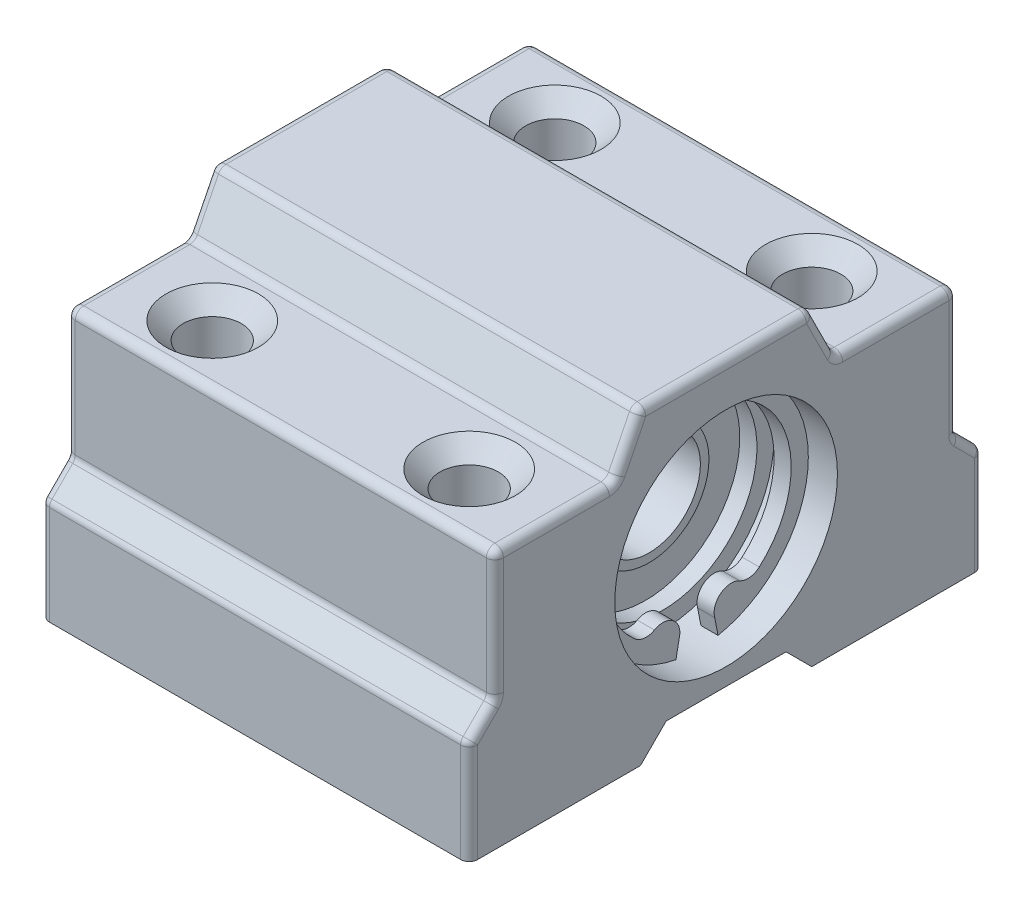
from build123d import *

# Parameters (mm, degrees)
SKETCH1_R           = 6.5
BOSS_EXTRUDE1_DEPTH = 25
EXTRUDE_THIN1_START = 0.5
SKETCH1_4_R         = 3.5
SKETCH1_4_R_2       = 3
EXTRUDE_THIN1_DEPTH = 20
BOSS_EXTRUDE2_START = 0.8
SKETCH1_5_R         = 5.5
SKETCH1_5_R_2       = 3
BOSS_EXTRUDE2_DEPTH = 19.5
BOSS_EXTRUDE3_START = 0.3
SKETCH1_6_R         = 6.5
SKETCH1_6_R_2       = 5.5
BOSS_EXTRUDE3_DEPTH = 21
BOSS_EXTRUDE4_START = 1
BOSS_EXTRUDE4_DEPTH = 1
FILLET1_R           = 0.5
SKETCH4_R           = 1.7
CUT_EXTRUDE3_DEPTH  = 35.263683398
CHAMFER1_SIZE       = 1


with BuildPart() as part:
    # Sketch1 → Boss-Extrude1 (new body)
    with BuildSketch(Plane(origin=(0, 0, 0), x_dir=(0, 0, -1), z_dir=(1, 0, 0))):
        Polygon((-15, -9), (-5, -9), (-3.5, -7.5), (3.5, -7.5), (5, -9), (15, -9), (15, -3), (13.5, -1.5), (13.5, 6), (6.5, 6), (5, 9), (-5, 9), (-6.5, 6), (-13.5, 6), (-13.5, -1.5), (-15, -3), align=None)
        Circle(SKETCH1_R, mode=Mode.SUBTRACT)
    extrude(amount=BOSS_EXTRUDE1_DEPTH)



with BuildPart() as body_2:
    # Sketch1<4> → Extrude-Thin1 (new body)
    with BuildSketch(Plane(origin=(0, 0, 0), x_dir=(0, 0, -1), z_dir=(1, 0, 0)).offset(EXTRUDE_THIN1_START)):
        Circle(SKETCH1_4_R)
        Circle(SKETCH1_4_R_2, mode=Mode.SUBTRACT)
    extrude(amount=EXTRUDE_THIN1_DEPTH)

    # Sketch1<5> → Boss-Extrude2 (add)
    with BuildSketch(Plane(origin=(0, 0, 0), x_dir=(0, 0, -1), z_dir=(1, 0, 0)).offset(BOSS_EXTRUDE2_START)):
        Circle(SKETCH1_5_R)
        Circle(SKETCH1_5_R_2, mode=Mode.SUBTRACT)
    extrude(amount=BOSS_EXTRUDE2_DEPTH)


with BuildPart() as part_1:
    add(part.part)

    add(body_2.part)  # Boss-Extrude3 merges body 2
    # Sketch1<6> → Boss-Extrude3 (add)
    with BuildSketch(Plane(origin=(0, 0, 0), x_dir=(0, 0, -1), z_dir=(1, 0, 0)).offset(BOSS_EXTRUDE3_START)):
        Circle(SKETCH1_6_R)
        Circle(SKETCH1_6_R_2, mode=Mode.SUBTRACT)
    extrude(amount=BOSS_EXTRUDE3_DEPTH)

    # Sketch3 → Boss-Extrude4 (add)
    with BuildSketch(Plane(origin=(21.3, 0, 0), x_dir=(0, 0, -1), z_dir=(1, 0, 0)).offset(BOSS_EXTRUDE4_START)):
        with BuildLine():
            Line((-1.039258499, -5.400920456), (-1.22821459, -6.382905993))
            ThreePointArc((-1.22821459, -6.382905993), (0, 6.5), (1.22821459, -6.382905993))
            Line((1.22821459, -6.382905993), (1.039258499, -5.400920456))
            ThreePointArc((1.039258499, -5.400920456), (1.377808725, -4.340610122), (2.487175706, -4.250171409))
            ThreePointArc((2.487175706, -4.250171409), (3.080776399, -4.371188169), (3.635318393, -4.12728242))
            ThreePointArc((3.635318393, -4.12728242), (0, 5.5), (-3.635318393, -4.12728242))
            ThreePointArc((-3.635318393, -4.12728242), (-3.080776399, -4.371188169), (-2.487175706, -4.250171409))
            ThreePointArc((-2.487175706, -4.250171409), (-1.377808725, -4.340610122), (-1.039258499, -5.400920456))
        make_face()
    extrude(amount=BOSS_EXTRUDE4_DEPTH)

    # Fillet1
    fillet1_edges = [part_1.edges().sort_by_distance(p)[0] for p in [
        (12.5, -1.5, -13.5),
        (12.5, -1.5, 13.5),
        (12.5, -3, 15),
        (12.5, -3, -15),
        (12.5, 6, -6.5),
        (12.5, 6, 6.5),
        (12.5, 9, 5),
        (12.5, 9, -5),
        (12.5, 6, -13.5),
        (12.5, 6, 13.5),
        (25, 7.5, -5.75),
        (25, 7.5, 5.75),
        (25, 2.25, 13.5),
        (0, -2.25, 14.25),
        (0, 7.5, 5.75),
        (25, -2.25, -14.25),
        (25, -6, -15),
        (25, 2.25, -13.5),
        (25, 9, 0),
        (25, 6, -10),
        (25, 6, 10),
        (25, -2.25, 14.25),
        (25, -6, 15),
        (0, -6, -15),
        (0, -2.25, -14.25),
        (0, 2.25, -13.5),
        (0, 7.5, -5.75),
        (0, 6, -10),
        (0, 9, 0),
        (0, -6, 15),
        (0, 2.25, 13.5),
        (0, 6, 10),
    ]]
    fillet(fillet1_edges, radius=FILLET1_R)

    # Sketch4 → Cut-Extrude3 (cut, through all)
    with BuildSketch(Plane.XZ.offset(9)):
        with Locations((5, 10)):
            Circle(SKETCH4_R)
        with Locations((20, 10)):
            Circle(SKETCH4_R)
        with Locations((20, -10)):
            Circle(SKETCH4_R)
        with Locations((5, -10)):
            Circle(SKETCH4_R)
    extrude(amount=-CUT_EXTRUDE3_DEPTH, mode=Mode.SUBTRACT)

    # Chamfer1
    chamfer1_edges = [part_1.edges().sort_by_distance(p)[0] for p in [
        (18.3, 6, -10),
        (3.3, 6, -10),
        (3.3, 6, 10),
        (18.3, 6, 10),
        (18.3, -9, 10),
        (3.3, -9, 10),
    ]]
    chamfer(chamfer1_edges, length=CHAMFER1_SIZE)


solid = part_1.part
